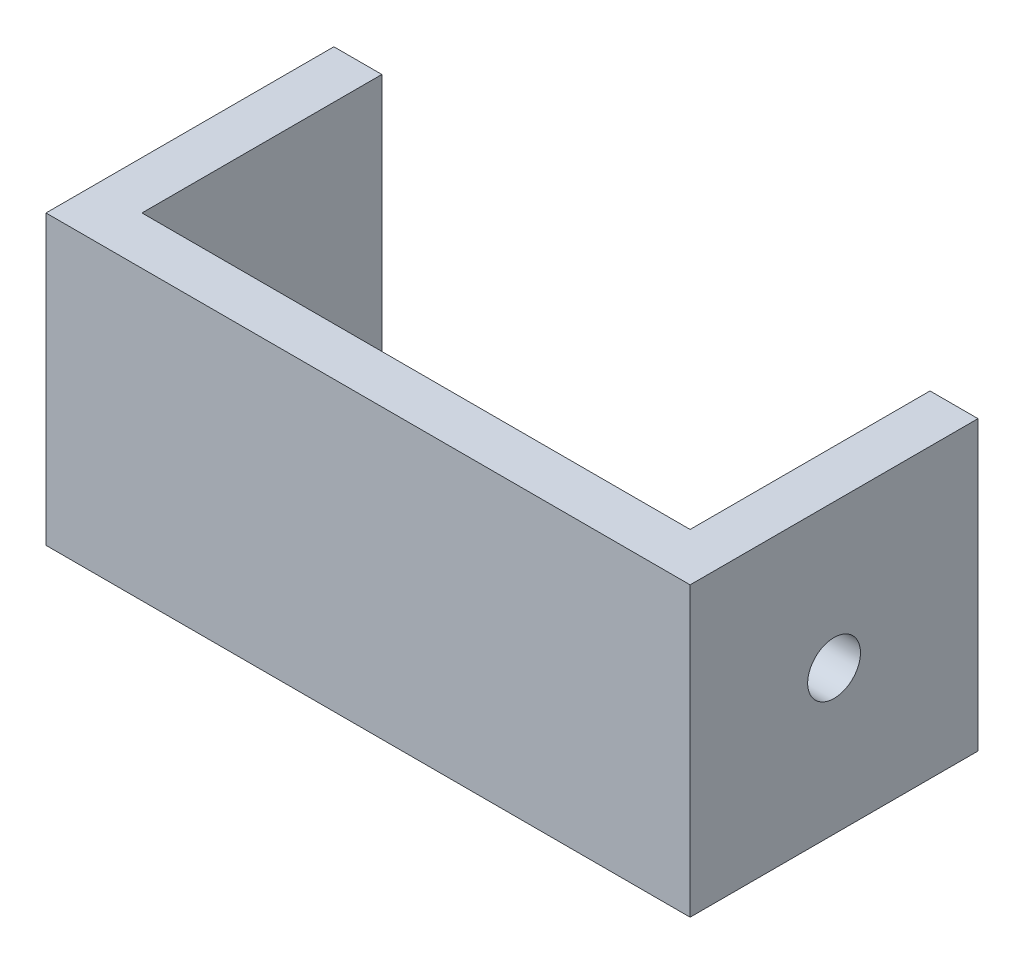
from build123d import *

# Parameters (mm, degrees)
SKETCH1_W           = 67.125
SKETCH1_H           = 30
BOSS_EXTRUDE1_DEPTH = 30
SKETCH2_W           = 57.125
SKETCH2_H           = 25
CUT_EXTRUDE1_DEPTH  = 25
SKETCH3_R           = 2.75
CUT_EXTRUDE2_DEPTH  = 76.038427655


with BuildPart() as part:
    # Sketch1 → Boss-Extrude1 (new body)
    with BuildSketch(Plane.XY):
        Rectangle(SKETCH1_W, SKETCH1_H)
    extrude(amount=BOSS_EXTRUDE1_DEPTH)

    # Sketch2 → Cut-Extrude1 (cut)
    with BuildSketch(Plane(origin=(0, 0, 0), x_dir=(-1, 0, 0), z_dir=(0, 0, -1))):
        with Locations((0, 2.5)):
            Rectangle(SKETCH2_W, SKETCH2_H)
    extrude(amount=-CUT_EXTRUDE1_DEPTH, mode=Mode.SUBTRACT)

    # Sketch3 → Cut-Extrude2 (cut, through all)
    with BuildSketch(Plane(origin=(33.5625, 0, 0), x_dir=(0, 0, -1), z_dir=(1, 0, 0))):
        with Locations((-15, 0)):
            Circle(SKETCH3_R)
    extrude(amount=-CUT_EXTRUDE2_DEPTH, mode=Mode.SUBTRACT)


solid = part.part
